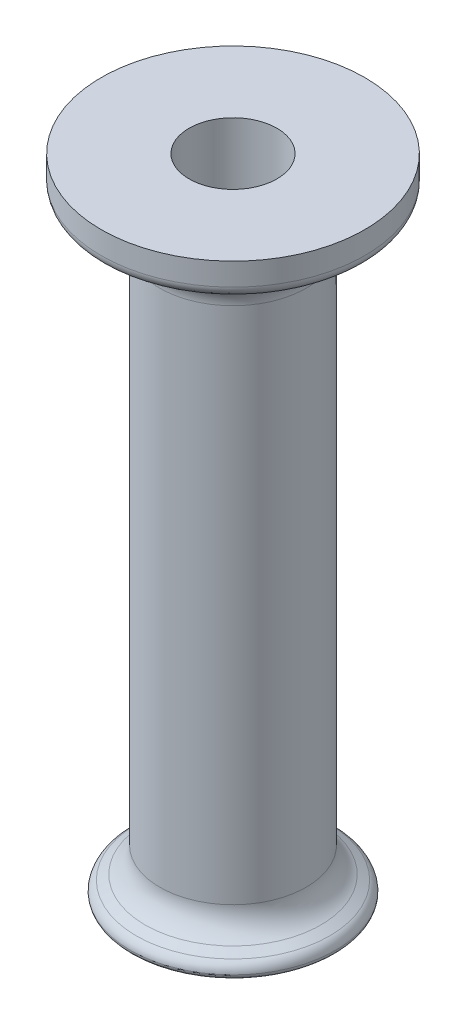
from build123d import *

# Parameters (mm, degrees)
FILLET1_R = 2


with BuildPart() as part:
    # Sketch1 → Revolve1 (revolve)
    with BuildSketch(Plane.YZ, mode=Mode.PRIVATE) as revolve1_sk:
        with BuildLine():
            Line((41.339745962, 12.5), (0, 12.5))
            Line((0, 12.5), (-47.226497308, 12.5))
            ThreePointArc((-47.226497308, 12.5), (-49.726497308, 13.169872981), (-51.556624327, 15))
            Line((-51.556624327, 15), (-52.422649731, 16.5))
            ThreePointArc((-52.422649731, 16.5), (-52.93730682, 17.086805764), (-53.637376906, 17.431935884))
            ThreePointArc((-53.637376906, 17.431935884), (-53.848936639, 17.476488917), (-54.064069414, 17.497945445))
            ThreePointArc((-54.064069414, 17.497945445), (-54.729407093, 17.184079888), (-55, 16.5))
            Line((-55, 16.5), (-55, 7.5))
            Line((-55, 7.5), (55, 7.5))
            Line((55, 7.5), (55, 22.5))
            Line((55, 22.5), (50, 22.5))
            Line((50, 22.5), (45.669872981, 15))
            ThreePointArc((45.669872981, 15), (43.839745962, 13.169872981), (41.339745962, 12.5))
        make_face()
    revolve(revolve1_sk.sketch.rotate(Axis((0, -16.105071473, 0), (0, 1, 0)), 180), axis=Axis((0, -16.105071473, 0), (0, 1, 0)))

    # Fillet1
    fillet1_edges = [part.edges().sort_by_distance(p)[0] for p in [
        (0, 50, 22.5),
    ]]
    fillet(fillet1_edges, radius=FILLET1_R)


solid = part.part
